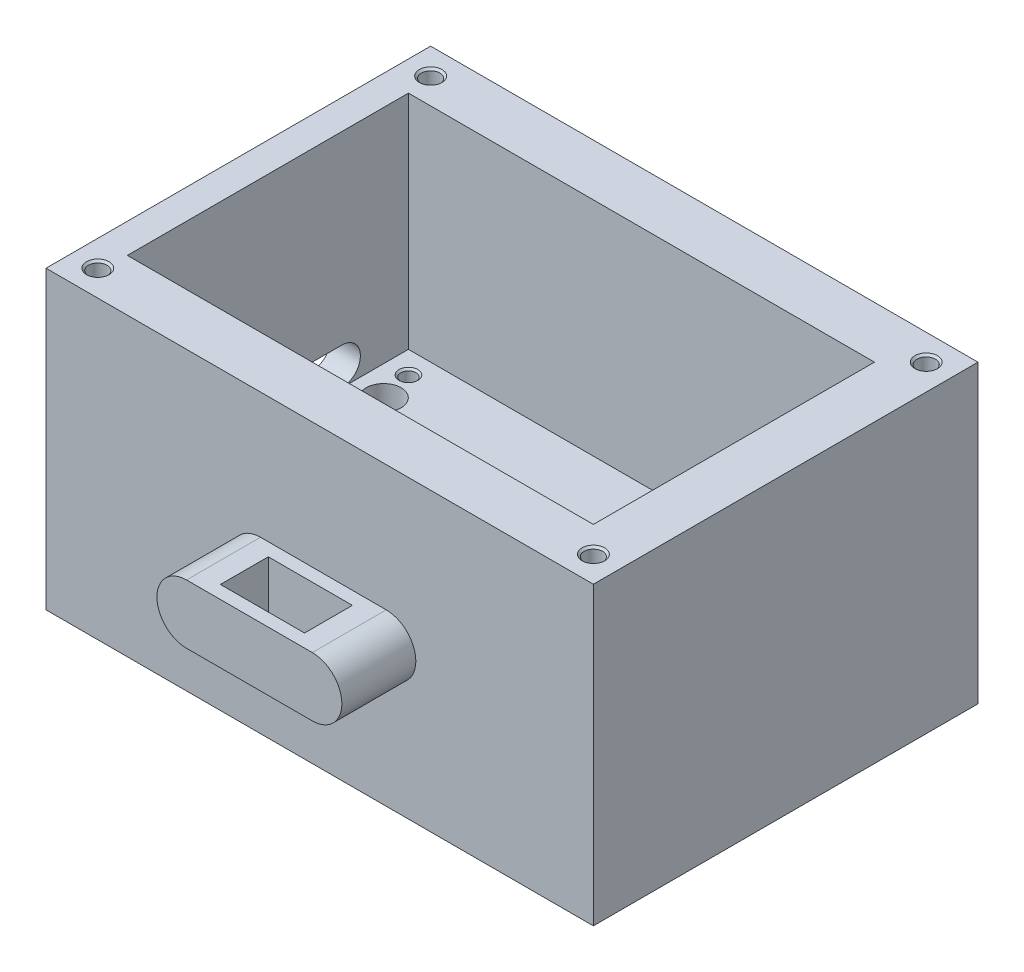
from build123d import *

# Parameters (mm, degrees)
SKETCH1_W                     = 74
SKETCH1_H                     = 52
BOSS_EXTRUDE2_DEPTH           = 40
SHELL3_T                      = -7
SHELL3_THICKNESS_2_FACE_W     = 38
SHELL3_THICKNESS_2_FACE_H     = 60
SHELL3_THICKNESS_2_DEPTH      = 3
SHELL3_THICKNESS_3_FACE_W     = 38
SHELL3_THICKNESS_3_FACE_H     = 30
SHELL3_THICKNESS_3_DEPTH      = 3
M3_TAPPED_HOLE1_D             = 2.5
M3_TAPPED_HOLE1_DEPTH         = 4
M3_TAPPED_HOLE1_CSINK_D       = 3.05
M3_TAPPED_HOLE1_CSINK_ANGLE   = 90
M3_TAPPED_HOLE1_TIP           = 0.751075774
M2_5_TAPPED_HOLE1_D           = 2.05
M2_5_TAPPED_HOLE1_DEPTH       = 4.5
M2_5_TAPPED_HOLE1_CSINK_D     = 2.55
M2_5_TAPPED_HOLE1_CSINK_ANGLE = 90
M2_5_TAPPED_HOLE1_TIP         = 0.615882135
CUT_EXTRUDE2_DEPTH            = 40
SKETCH24_R                    = 2.358495283
CUT_EXTRUDE3_DEPTH            = 40
CUT_EXTRUDE4_DEPTH            = 1
BOSS_EXTRUDE4_DEPTH           = 10
BOSS_EXTRUDE5_START           = 10
BOSS_EXTRUDE5_DEPTH           = 10
SKETCH50_W                    = 11.37301756
SKETCH50_H                    = 6.472311436
CUT_EXTRUDE6_DEPTH            = 10


with BuildPart() as part:
    # Sketch1 → Boss-Extrude2 (new body)
    with BuildSketch(Plane(origin=(0, 0, 0), x_dir=(1, 0, 0), z_dir=(0, 1, 0))):
        Rectangle(SKETCH1_W, SKETCH1_H)
    extrude(amount=BOSS_EXTRUDE2_DEPTH)

    # Shell3
    shell3_openings = [part.faces().sort_by_distance(p)[0] for p in [
        (0, 40, 0),
    ]]
    offset(amount=SHELL3_T, openings=shell3_openings, kind=Kind.INTERSECTION)

    # Shell3 thickness 2 face (on inner face of the shell) → Shell3 thickness 2 (add)
    with BuildSketch(Plane(origin=(0, 7, 0), x_dir=(0, 0, -1), z_dir=(0, -1, 0))):
        Rectangle(SHELL3_THICKNESS_2_FACE_W, SHELL3_THICKNESS_2_FACE_H)
    extrude(amount=-SHELL3_THICKNESS_2_DEPTH)

    # Shell3 thickness 3 face (on inner face of the shell) → Shell3 thickness 3 (cut)
    with BuildSketch(Plane(origin=(-30, 25, 0), x_dir=(0, 0, -1), z_dir=(-1, 0, 0))):
        Rectangle(SHELL3_THICKNESS_3_FACE_W, SHELL3_THICKNESS_3_FACE_H)
    extrude(amount=SHELL3_THICKNESS_3_DEPTH, mode=Mode.SUBTRACT)

    # M3 Tapped Hole1
    with Locations(Plane(origin=(0, 40, 0), x_dir=(1, 0, 0), z_dir=(0, 1, 0))):
        with Locations((-33.5, 22.5), (-33.5, -22.5), (33.5, -22.5), (33.5, 22.5)):
            CounterSinkHole(M3_TAPPED_HOLE1_D / 2, M3_TAPPED_HOLE1_CSINK_D / 2, depth=M3_TAPPED_HOLE1_DEPTH, counter_sink_angle=M3_TAPPED_HOLE1_CSINK_ANGLE)
            with Locations((0, 0, -(M3_TAPPED_HOLE1_DEPTH + M3_TAPPED_HOLE1_TIP / 2))):  # 118° drill point
                Cone(0, M3_TAPPED_HOLE1_D / 2, M3_TAPPED_HOLE1_TIP, mode=Mode.SUBTRACT)

    # M2.5 Tapped Hole1
    with Locations(Plane(origin=(0, 10, 0), x_dir=(1, 0, 0), z_dir=(0, 1, 0))):
        with Locations((-30, 16), (-30, -7), (17, -7), (17, 16)):
            CounterSinkHole(M2_5_TAPPED_HOLE1_D / 2, M2_5_TAPPED_HOLE1_CSINK_D / 2, depth=M2_5_TAPPED_HOLE1_DEPTH, counter_sink_angle=M2_5_TAPPED_HOLE1_CSINK_ANGLE)
            with Locations((0, 0, -(M2_5_TAPPED_HOLE1_DEPTH + M2_5_TAPPED_HOLE1_TIP / 2))):  # 118° drill point
                Cone(0, M2_5_TAPPED_HOLE1_D / 2, M2_5_TAPPED_HOLE1_TIP, mode=Mode.SUBTRACT)

    # Sketch15 → Cut-Extrude2 (cut)
    with BuildSketch(Plane(origin=(-33, 0, 0), x_dir=(0, 0, -1), z_dir=(1, 0, 0))):
        with BuildLine():
            Line((-1, 15), (10, 15))
            ThreePointArc((10, 15), (12.5, 12.5), (10, 10))
            Line((10, 10), (-1, 10))
            ThreePointArc((-1, 10), (-3.5, 12.5), (-1, 15))
        make_face()
    extrude(amount=-CUT_EXTRUDE2_DEPTH, mode=Mode.SUBTRACT)

    # Sketch24 → Cut-Extrude3 (cut)
    with BuildSketch(Plane(origin=(0, 10, 0), x_dir=(1, 0, 0), z_dir=(0, 1, 0))):
        with Locations(Location((-29.004473736, 11.654457193, 0), (0, 0, 270))):
            Circle(SKETCH24_R)
        with Locations(Location((-29.004473736, -2.654457193, 0), (0, 0, 90))):
            Circle(SKETCH24_R)
    extrude(amount=-CUT_EXTRUDE3_DEPTH, mode=Mode.SUBTRACT)

    # Sketch28 → Cut-Extrude4 (cut)
    # profile 1 of 6: a face of its own
    with BuildSketch(Plane.XZ):
        with BuildLine():
            Line((-21.066376407, -7.531290331), (-21.066376407, -8.055729433))
            add(Edge.make_bspline(
                [(-21.066376407, -8.055729433), (-21.066493481, -8.094299967), (-21.066719963, -8.168915559), (-21.072749774, -8.27693019), (-21.081048995, -8.377238794), (-21.091717195, -8.470261613), (-21.107284017, -8.555365956), (-21.125347348, -8.63318104), (-21.1466004, -8.703226112), (-21.180423496, -8.785501362), (-21.231981971, -8.878421953), (-21.307299864, -8.979904321), (-21.400187205, -9.067524933), (-21.504485505, -9.144296198), (-21.618724783, -9.20670145), (-21.739755436, -9.250929045), (-21.865092478, -9.278828123), (-21.950347801, -9.282331474), (-21.993259419, -9.284094818)],
                knots=[0, 0, 0, 0, 1.06018614, 2.050954666, 2.972944401, 3.827238501, 4.623718643, 5.349931156, 6.022584593, 6.633456976, 7.792309932, 8.93465979, 10.093370254, 11.288470473, 12.487312474, 13.658161002, 14.821280605, 16, 16, 16, 16], degree=3))
            add(Edge.make_bspline(
                [(-21.993259419, -9.284094818), (-22.029315806, -9.282784604), (-22.100685306, -9.280191185), (-22.20625438, -9.262372968), (-22.308458266, -9.231788267), (-22.406992389, -9.190093008), (-22.499789336, -9.136681652), (-22.585407581, -9.072359067), (-22.663079019, -8.997075716), (-22.707647061, -8.93993448), (-22.730138426, -8.911098023)],
                knots=[0, 0, 0, 0, 1.008802286, 1.996808917, 2.985853824, 3.987935791, 4.984003692, 5.974085787, 6.977617699, 8, 8, 8, 8], degree=3))
            add(Edge.make_bspline(
                [(-22.730138426, -8.911098023), (-22.757582169, -8.948013976), (-22.811179869, -9.020110928), (-22.903915455, -9.114367701), (-23.002713332, -9.194348448), (-23.108014323, -9.260736498), (-23.221075133, -9.311076519), (-23.340350571, -9.347795106), (-23.466410698, -9.370189878), (-23.55269546, -9.372605673), (-23.596724964, -9.373838407)],
                knots=[0, 0, 0, 0, 1.076867414, 2.103124847, 3.088410714, 4.050300241, 5.011160291, 5.979497965, 6.968975523, 8, 8, 8, 8], degree=3))
            add(Edge.make_bspline(
                [(-23.596724964, -9.373838407), (-23.642689963, -9.372216484), (-23.733631908, -9.369007501), (-23.866364959, -9.339444435), (-23.993710285, -9.294014739), (-24.11216762, -9.229073032), (-24.220858532, -9.152541667), (-24.315033419, -9.064640327), (-24.39440334, -8.968749758), (-24.448433343, -8.880897857), (-24.482877049, -8.804361136), (-24.505166919, -8.74099831), (-24.524284088, -8.671678937), (-24.539060254, -8.596124598), (-24.552180152, -8.51482486), (-24.559829291, -8.427430385), (-24.566070642, -8.334164484), (-24.566272342, -8.269817747), (-24.566376407, -8.236618856)],
                knots=[0, 0, 0, 0, 1.303821814, 2.579616968, 3.843651152, 5.132519217, 6.403349193, 7.610310239, 8.779728434, 9.929465596, 10.526588542, 11.160606602, 11.83532446, 12.566903716, 13.346076185, 14.172979721, 15.057371846, 16, 16, 16, 16], degree=3))
            Line((-24.566376407, -8.236618856), (-24.566376407, -7.040505074))
            Line((-24.566376407, -7.040505074), (-21.066376407, -7.531290331))
        make_face()
        with BuildLine():
            Line((-22.457402048, -7.968790331), (-22.457402048, -8.083774305))
            add(Edge.make_bspline(
                [(-22.457402048, -8.083774305), (-22.457310171, -8.104578187), (-22.457134624, -8.144327724), (-22.454662489, -8.201104012), (-22.452492769, -8.252857304), (-22.447151493, -8.299308203), (-22.442087999, -8.340833196), (-22.434699294, -8.376745303), (-22.427647017, -8.40801075), (-22.414402069, -8.442315778), (-22.393192786, -8.480824328), (-22.358512423, -8.52163605), (-22.31632509, -8.559753033), (-22.26583748, -8.592915553), (-22.209669148, -8.620800675), (-22.149315493, -8.64111813), (-22.08583696, -8.653439438), (-22.042626966, -8.655062452), (-22.020603169, -8.655889689)],
                knots=[0, 0, 0, 0, 1.199266251, 2.2914127, 3.276493939, 4.184169076, 4.986412771, 5.686674651, 6.297778951, 6.830813506, 7.80188044, 8.816289487, 9.903938403, 11.069891582, 12.287113832, 13.509990689, 14.730861672, 16, 16, 16, 16], degree=3))
            add(Edge.make_bspline(
                [(-22.020603169, -8.655889689), (-22.000460654, -8.655233615), (-21.961056668, -8.653950164), (-21.904341876, -8.643501645), (-21.851954912, -8.625625951), (-21.804582942, -8.601149865), (-21.762261832, -8.571423136), (-21.727687289, -8.536004149), (-21.70016231, -8.496535774), (-21.683516978, -8.459300799), (-21.673338741, -8.425088648), (-21.66744149, -8.393320944), (-21.661814447, -8.355911062), (-21.656920366, -8.312661533), (-21.653514229, -8.263539923), (-21.651655834, -8.208585036), (-21.650210513, -8.147817206), (-21.649881474, -8.105276356), (-21.64970974, -8.083073183)],
                knots=[0, 0, 0, 0, 1.218011353, 2.382746143, 3.473745603, 4.555082274, 5.598789101, 6.588623339, 7.533826788, 8.495697709, 9.041472227, 9.69032969, 10.448187854, 11.330378243, 12.32263311, 13.426294144, 14.656716176, 16, 16, 16, 16], degree=3))
            Line((-21.64970974, -8.083073183), (-22.457402048, -7.968790331))
        make_face(mode=Mode.SUBTRACT)
        with BuildLine():
            Line((-23.983043073, -7.756350427), (-23.997065509, -8.161598824))
            add(Edge.make_bspline(
                [(-23.997065509, -8.161598824), (-23.996641291, -8.186149952), (-23.99581998, -8.233682309), (-23.990106233, -8.302505842), (-23.981367683, -8.366305178), (-23.968334625, -8.424854199), (-23.950174509, -8.477742066), (-23.93057028, -8.526425285), (-23.905869187, -8.569616256), (-23.87688385, -8.607214856), (-23.844021719, -8.639199204), (-23.809893626, -8.668745522), (-23.771849867, -8.692325501), (-23.731039327, -8.711516139), (-23.68782649, -8.72677893), (-23.641647414, -8.738342169), (-23.592682526, -8.744402481), (-23.559112775, -8.745218308), (-23.542037464, -8.745633279)],
                knots=[0, 0, 0, 0, 1.396066714, 2.702863338, 3.924573081, 5.056214113, 6.106916433, 7.10166022, 8.036348374, 8.926907695, 9.791502282, 10.640636188, 11.488729362, 12.326976486, 13.201322448, 14.090988778, 15.028978228, 16, 16, 16, 16], degree=3))
            add(Edge.make_bspline(
                [(-23.542037464, -8.745633279), (-23.516701752, -8.744574141), (-23.467132268, -8.74250193), (-23.395036356, -8.725576567), (-23.327085828, -8.69889822), (-23.264095559, -8.661528655), (-23.207383741, -8.615852819), (-23.159803334, -8.561447237), (-23.120765214, -8.500603102), (-23.095798792, -8.443281247), (-23.080072453, -8.39089617), (-23.071025345, -8.342861682), (-23.061289369, -8.287123898), (-23.055231724, -8.222867608), (-23.048348161, -8.150723919), (-23.044648393, -8.070479705), (-23.041729912, -7.982132302), (-23.041076744, -7.920415987), (-23.040735381, -7.888161324)],
                knots=[0, 0, 0, 0, 1.072645095, 2.098636998, 3.121276761, 4.155791168, 5.190684831, 6.194199094, 7.205309944, 8.243185402, 8.832331474, 9.519981703, 10.31298152, 11.2295869, 12.253664638, 13.384370407, 14.632999216, 16, 16, 16, 16], degree=3))
            Line((-23.040735381, -7.888161324), (-23.983043073, -7.756350427))
        make_face(mode=Mode.SUBTRACT)
    # profile 2 of 6: a face of its own
    with BuildSketch(Plane.XZ):
        with BuildLine():
            add(Edge.make_bspline(
                [(-21.963812304, -11.297716613), (-21.964071323, -11.32601783), (-21.964583955, -11.382029728), (-21.973085168, -11.465058538), (-21.984445156, -11.546164685), (-22.001588258, -11.625275701), (-22.023164205, -11.702383431), (-22.050079806, -11.77771802), (-22.081319282, -11.851199178), (-22.118011107, -11.921980931), (-22.158552322, -11.990012085), (-22.203266686, -12.054666239), (-22.252796154, -12.114867426), (-22.305209547, -12.172303544), (-22.362883564, -12.224554999), (-22.424176414, -12.273042191), (-22.489053427, -12.318351228), (-22.557914297, -12.359414813), (-22.630337386, -12.395576586), (-22.704464204, -12.428232667), (-22.781437115, -12.454915125), (-22.860521725, -12.476164592), (-22.941538799, -12.494470213), (-23.024855905, -12.505523666), (-23.110201586, -12.51413082), (-23.167848537, -12.514617313), (-23.197085541, -12.514864048)],
                knots=[0, 0, 0, 0, 1.048386327, 2.074896855, 3.090385118, 4.082517109, 5.072415802, 6.055927494, 7.045409252, 8.029378534, 9.00830257, 9.979030121, 10.939501578, 11.895667195, 12.858206409, 13.820004862, 14.790732413, 15.788970817, 16.788373479, 17.78923893, 18.789091909, 19.804025916, 20.823385529, 21.864591044, 22.916977224, 24, 24, 24, 24], degree=3))
            add(Edge.make_bspline(
                [(-23.197085541, -12.514864048), (-23.245291767, -12.513431398), (-23.340238093, -12.510609669), (-23.479910674, -12.490823337), (-23.613810475, -12.457012039), (-23.742309564, -12.409660517), (-23.865498587, -12.349153494), (-23.983149544, -12.275031015), (-24.095008815, -12.187480316), (-24.200289717, -12.08779976), (-24.295928121, -11.977904364), (-24.381214384, -11.861165345), (-24.451771511, -11.737103133), (-24.510860689, -11.607355617), (-24.555506622, -11.47060455), (-24.587537122, -11.327878884), (-24.608018449, -11.178884395), (-24.610157924, -11.077398548), (-24.611248202, -11.025681356)],
                knots=[0, 0, 0, 0, 1.011045048, 1.991340582, 2.952024262, 3.902762956, 4.858644223, 5.82568574, 6.814147443, 7.833642768, 8.862033131, 9.866161463, 10.860924258, 11.85045512, 12.85189938, 13.872278278, 14.915712917, 16, 16, 16, 16], degree=3))
            add(Edge.make_bspline(
                [(-24.611248202, -11.025681356), (-24.610422814, -10.980993326), (-24.608810024, -10.893673902), (-24.592814058, -10.766335957), (-24.567947609, -10.645582502), (-24.532207479, -10.53189733), (-24.486430645, -10.425215958), (-24.430601399, -10.325519237), (-24.364738295, -10.232506784), (-24.287984288, -10.148161236), (-24.204018253, -10.071416656), (-24.112715688, -10.004778704), (-24.014961248, -9.948165691), (-23.911229935, -9.901634218), (-23.800658146, -9.866976675), (-23.684677745, -9.840742838), (-23.562096836, -9.825090456), (-23.478280742, -9.82341314), (-23.435466952, -9.822556356)],
                knots=[0, 0, 0, 0, 1.130479594, 2.208932189, 3.242528798, 4.24708251, 5.219446299, 6.175409344, 7.133894192, 8.097148648, 9.056016668, 10.008368175, 10.951843583, 11.910328432, 12.879268204, 13.879441713, 14.916805437, 16, 16, 16, 16], degree=3))
            add(Edge.make_bspline(
                [(-23.435466952, -9.822556356), (-23.383756982, -9.823942902), (-23.282032104, -9.826670543), (-23.132707369, -9.847014665), (-22.990483056, -9.882395552), (-22.854723047, -9.930837424), (-22.726059814, -9.993646898), (-22.603572287, -10.069860199), (-22.488587188, -10.16084656), (-22.381507552, -10.264108762), (-22.284190555, -10.376223895), (-22.197995353, -10.493777249), (-22.126574424, -10.616934393), (-22.065683282, -10.743423319), (-22.020671406, -10.875946629), (-21.987434701, -11.012433403), (-21.967173913, -11.153612011), (-21.964942376, -11.249272968), (-21.963812304, -11.297716613)],
                knots=[0, 0, 0, 0, 1.070531339, 2.105970474, 3.112964683, 4.100244114, 5.084970514, 6.071870378, 7.081570052, 8.115141744, 9.147591351, 10.152304076, 11.128312213, 12.091581256, 13.054169389, 14.02010879, 14.997363732, 16, 16, 16, 16], degree=3))
        make_face()
        with BuildLine():
            add(Edge.make_bspline(
                [(-22.547145637, -11.251442574), (-22.547908418, -11.220081751), (-22.549394997, -11.158962825), (-22.562254011, -11.070113336), (-22.583207164, -10.986861605), (-22.612524034, -10.908876392), (-22.6516997, -10.837263227), (-22.697833368, -10.770341036), (-22.754279144, -10.710794596), (-22.816909708, -10.656509872), (-22.884755563, -10.608638093), (-22.954765871, -10.5668093), (-23.025841141, -10.530205756), (-23.099022945, -10.502133489), (-23.172963659, -10.478157138), (-23.248640258, -10.462287833), (-23.325863237, -10.453071702), (-23.377716517, -10.45153695), (-23.403916471, -10.450761484)],
                knots=[0, 0, 0, 0, 1.147823303, 2.236986163, 3.278866926, 4.286447048, 5.278094165, 6.260951849, 7.253964134, 8.273106082, 9.291744946, 10.289685726, 11.257906124, 12.214523359, 13.156367631, 14.101277975, 15.040631004, 16, 16, 16, 16], degree=3))
            add(Edge.make_bspline(
                [(-23.403916471, -10.450761484), (-23.426838522, -10.451344365), (-23.47164654, -10.45248378), (-23.537178707, -10.46008734), (-23.599050878, -10.473588385), (-23.657713573, -10.491579537), (-23.712850526, -10.51578007), (-23.764679947, -10.544977699), (-23.812668956, -10.580035133), (-23.857778703, -10.61875424), (-23.897173961, -10.663193391), (-23.933018386, -10.710269278), (-23.962387293, -10.761764805), (-23.986192618, -10.816897877), (-24.005201102, -10.875062926), (-24.018609618, -10.936825639), (-24.026194126, -11.002119655), (-24.027332513, -11.046929198), (-24.027914868, -11.069852029)],
                knots=[0, 0, 0, 0, 1.110072676, 2.169969703, 3.188890406, 4.173283012, 5.136298252, 6.099313492, 7.047922057, 8.010405097, 8.971956079, 9.918130923, 10.871319561, 11.834334801, 12.822169691, 13.830030297, 14.889927324, 16, 16, 16, 16], degree=3))
            add(Edge.make_bspline(
                [(-24.027914868, -11.069852029), (-24.027083372, -11.102139252), (-24.025462658, -11.165071982), (-24.013581477, -11.256495164), (-23.993405887, -11.341900569), (-23.964520504, -11.421263253), (-23.926997267, -11.494500215), (-23.882163052, -11.562511181), (-23.828148792, -11.62375824), (-23.767204356, -11.678898876), (-23.701031157, -11.727384063), (-23.631613206, -11.769586311), (-23.560578331, -11.806589697), (-23.486148861, -11.834816532), (-23.410481789, -11.858587739), (-23.331986267, -11.87440774), (-23.251338062, -11.884551176), (-23.196648986, -11.885951835), (-23.169040669, -11.88665892)],
                knots=[0, 0, 0, 0, 1.164159755, 2.269125213, 3.317790587, 4.322983768, 5.306749412, 6.279149638, 7.252754391, 8.243176293, 9.237713415, 10.206161075, 11.171081751, 12.121090975, 13.072855638, 14.02823303, 15.004606195, 16, 16, 16, 16], degree=3))
            add(Edge.make_bspline(
                [(-23.169040669, -11.88665892), (-23.146571924, -11.886162759), (-23.102407058, -11.885187496), (-23.0379783, -11.876270421), (-22.976394128, -11.863630613), (-22.918732447, -11.843244271), (-22.863464789, -11.819226848), (-22.812393521, -11.787873708), (-22.764172286, -11.751837125), (-22.719411761, -11.71059691), (-22.679114042, -11.664674304), (-22.643762297, -11.615054966), (-22.613368049, -11.562698642), (-22.589558086, -11.506474053), (-22.570650952, -11.447324035), (-22.556369202, -11.385004941), (-22.548903794, -11.319166522), (-22.547740655, -11.274362554), (-22.547145637, -11.251442574)],
                knots=[0, 0, 0, 0, 1.078934166, 2.120767328, 3.120729662, 4.093721461, 5.053732062, 6.010848681, 6.965326793, 7.94277936, 8.929412498, 9.895380872, 10.866167073, 11.831939623, 12.822717627, 13.847035637, 14.898626599, 16, 16, 16, 16], degree=3))
        make_face(mode=Mode.SUBTRACT)
    # profile 3 of 6: a face of its own
    with BuildSketch(Plane.XZ):
        with BuildLine():
            add(Edge.make_bspline(
                [(-21.963812304, -14.393870459), (-21.964071323, -14.422171676), (-21.964583955, -14.478183574), (-21.973085168, -14.561212384), (-21.984445156, -14.642318531), (-22.001588258, -14.721429547), (-22.023164205, -14.798537277), (-22.050079806, -14.873871866), (-22.081319282, -14.947353025), (-22.118011107, -15.018134777), (-22.158552322, -15.086165931), (-22.203266686, -15.150820085), (-22.252796154, -15.211021272), (-22.305209547, -15.26845739), (-22.362883564, -15.320708845), (-22.424176414, -15.369196037), (-22.489053427, -15.414505074), (-22.557914297, -15.455568659), (-22.630337386, -15.491730432), (-22.704464204, -15.524386513), (-22.781437115, -15.551068971), (-22.860521725, -15.572318439), (-22.941538799, -15.590624059), (-23.024855905, -15.601677512), (-23.110201586, -15.610284667), (-23.167848537, -15.610771159), (-23.197085541, -15.611017895)],
                knots=[0, 0, 0, 0, 1.048386327, 2.074896855, 3.090385118, 4.082517109, 5.072415802, 6.055927494, 7.045409252, 8.029378534, 9.00830257, 9.979030121, 10.939501578, 11.895667195, 12.858206409, 13.820004862, 14.790732413, 15.788970817, 16.788373479, 17.78923893, 18.789091909, 19.804025916, 20.823385529, 21.864591044, 22.916977224, 24, 24, 24, 24], degree=3))
            add(Edge.make_bspline(
                [(-23.197085541, -15.611017895), (-23.245291767, -15.609585244), (-23.340238093, -15.606763515), (-23.479910674, -15.586977183), (-23.613810475, -15.553165885), (-23.742309564, -15.505814363), (-23.865498587, -15.445307341), (-23.983149544, -15.371184861), (-24.095008815, -15.283634162), (-24.200289717, -15.183953606), (-24.295928121, -15.074058211), (-24.381214384, -14.957319191), (-24.451771511, -14.833256979), (-24.510860689, -14.703509464), (-24.555506622, -14.566758396), (-24.587537122, -14.42403273), (-24.608018449, -14.275038241), (-24.610157924, -14.173552394), (-24.611248202, -14.121835202)],
                knots=[0, 0, 0, 0, 1.011045048, 1.991340582, 2.952024262, 3.902762956, 4.858644223, 5.82568574, 6.814147443, 7.833642768, 8.862033131, 9.866161463, 10.860924258, 11.85045512, 12.85189938, 13.872278278, 14.915712917, 16, 16, 16, 16], degree=3))
            add(Edge.make_bspline(
                [(-24.611248202, -14.121835202), (-24.610422814, -14.077147173), (-24.608810024, -13.989827748), (-24.592814058, -13.862489804), (-24.567947609, -13.741736348), (-24.532207479, -13.628051176), (-24.486430645, -13.521369804), (-24.430601399, -13.421673083), (-24.364738295, -13.32866063), (-24.287984288, -13.244315082), (-24.204018253, -13.167570502), (-24.112715688, -13.10093255), (-24.014961248, -13.044319537), (-23.911229935, -12.997788064), (-23.800658146, -12.963130522), (-23.684677745, -12.936896685), (-23.562096836, -12.921244303), (-23.478280742, -12.919566986), (-23.435466952, -12.918710202)],
                knots=[0, 0, 0, 0, 1.130479594, 2.208932189, 3.242528798, 4.24708251, 5.219446299, 6.175409344, 7.133894192, 8.097148648, 9.056016668, 10.008368175, 10.951843583, 11.910328432, 12.879268204, 13.879441713, 14.916805437, 16, 16, 16, 16], degree=3))
            add(Edge.make_bspline(
                [(-23.435466952, -12.918710202), (-23.383756982, -12.920096748), (-23.282032104, -12.922824389), (-23.132707369, -12.943168511), (-22.990483056, -12.978549398), (-22.854723047, -13.02699127), (-22.726059814, -13.089800744), (-22.603572287, -13.166014045), (-22.488587188, -13.257000406), (-22.381507552, -13.360262609), (-22.284190555, -13.472377741), (-22.197995353, -13.589931095), (-22.126574424, -13.71308824), (-22.065683282, -13.839577166), (-22.020671406, -13.972100475), (-21.987434701, -14.108587249), (-21.967173913, -14.249765857), (-21.964942376, -14.345426815), (-21.963812304, -14.393870459)],
                knots=[0, 0, 0, 0, 1.070531339, 2.105970474, 3.112964683, 4.100244114, 5.084970514, 6.071870378, 7.081570052, 8.115141744, 9.147591351, 10.152304076, 11.128312213, 12.091581256, 13.054169389, 14.02010879, 14.997363732, 16, 16, 16, 16], degree=3))
        make_face()
        with BuildLine():
            add(Edge.make_bspline(
                [(-22.547145637, -14.34759642), (-22.547908418, -14.316235597), (-22.549394997, -14.255116672), (-22.562254011, -14.166267182), (-22.583207164, -14.083015451), (-22.612524034, -14.005030238), (-22.6516997, -13.933417073), (-22.697833368, -13.866494882), (-22.754279144, -13.806948442), (-22.816909708, -13.752663718), (-22.884755563, -13.704791939), (-22.954765871, -13.662963146), (-23.025841141, -13.626359602), (-23.099022945, -13.598287335), (-23.172963659, -13.574310984), (-23.248640258, -13.558441679), (-23.325863237, -13.549225548), (-23.377716517, -13.547690796), (-23.403916471, -13.546915331)],
                knots=[0, 0, 0, 0, 1.147823303, 2.236986163, 3.278866926, 4.286447048, 5.278094165, 6.260951849, 7.253964134, 8.273106082, 9.291744946, 10.289685726, 11.257906124, 12.214523359, 13.156367631, 14.101277975, 15.040631004, 16, 16, 16, 16], degree=3))
            add(Edge.make_bspline(
                [(-23.403916471, -13.546915331), (-23.426838522, -13.547498211), (-23.47164654, -13.548637626), (-23.537178707, -13.556241186), (-23.599050878, -13.569742231), (-23.657713573, -13.587733383), (-23.712850526, -13.611933916), (-23.764679947, -13.641131545), (-23.812668956, -13.676188979), (-23.857778703, -13.714908086), (-23.897173961, -13.759347237), (-23.933018386, -13.806423124), (-23.962387293, -13.857918651), (-23.986192618, -13.913051723), (-24.005201102, -13.971216772), (-24.018609618, -14.032979485), (-24.026194126, -14.098273501), (-24.027332513, -14.143083044), (-24.027914868, -14.166005875)],
                knots=[0, 0, 0, 0, 1.110072676, 2.169969703, 3.188890406, 4.173283012, 5.136298252, 6.099313492, 7.047922057, 8.010405097, 8.971956079, 9.918130923, 10.871319561, 11.834334801, 12.822169691, 13.830030297, 14.889927324, 16, 16, 16, 16], degree=3))
            add(Edge.make_bspline(
                [(-24.027914868, -14.166005875), (-24.027083372, -14.198293098), (-24.025462658, -14.261225828), (-24.013581477, -14.35264901), (-23.993405887, -14.438054415), (-23.964520504, -14.517417099), (-23.926997267, -14.590654061), (-23.882163052, -14.658665027), (-23.828148792, -14.719912087), (-23.767204356, -14.775052722), (-23.701031157, -14.823537909), (-23.631613206, -14.865740157), (-23.560578331, -14.902743544), (-23.486148861, -14.930970378), (-23.410481789, -14.954741585), (-23.331986267, -14.970561586), (-23.251338062, -14.980705022), (-23.196648986, -14.982105681), (-23.169040669, -14.982812766)],
                knots=[0, 0, 0, 0, 1.164159755, 2.269125213, 3.317790587, 4.322983768, 5.306749412, 6.279149638, 7.252754391, 8.243176293, 9.237713415, 10.206161075, 11.171081751, 12.121090975, 13.072855638, 14.02823303, 15.004606195, 16, 16, 16, 16], degree=3))
            add(Edge.make_bspline(
                [(-23.169040669, -14.982812766), (-23.146571924, -14.982316605), (-23.102407058, -14.981341343), (-23.0379783, -14.972424268), (-22.976394128, -14.95978446), (-22.918732447, -14.939398117), (-22.863464789, -14.915380695), (-22.812393521, -14.884027554), (-22.764172286, -14.847990972), (-22.719411761, -14.806750756), (-22.679114042, -14.76082815), (-22.643762297, -14.711208812), (-22.613368049, -14.658852488), (-22.589558086, -14.602627899), (-22.570650952, -14.543477882), (-22.556369202, -14.481158787), (-22.548903794, -14.415320368), (-22.547740655, -14.3705164), (-22.547145637, -14.34759642)],
                knots=[0, 0, 0, 0, 1.078934166, 2.120767328, 3.120729662, 4.093721461, 5.053732062, 6.010848681, 6.965326793, 7.94277936, 8.929412498, 9.895380872, 10.866167073, 11.831939623, 12.822717627, 13.847035637, 14.898626599, 16, 16, 16, 16], degree=3))
        make_face(mode=Mode.SUBTRACT)
    # profile 4 of 6: a face of its own
    with BuildSketch(Plane.XZ):
        Polygon((-20.976632817, -16.467788728), (-20.976632817, -17.100901709), (-22.008684099, -16.957872863), (-22.008684099, -17.358213407), (-22.547145637, -17.282492254), (-22.547145637, -16.882852831), (-24.566376407, -16.603105234), (-24.566376407, -15.969992254), (-22.547145637, -16.24973985), (-22.547145637, -15.939844016), (-22.008684099, -16.012760683), (-22.008684099, -16.324759882), align=None)
    # profile 5 of 6: a face of its own
    with BuildSketch(Plane.XZ):
        with BuildLine():
            Line((-22.008684099, 2.381019693), (-22.008684099, 1.747205591))
            Line((-22.008684099, 1.747205591), (-22.291236182, 1.787169533))
            add(Edge.make_bspline(
                [(-22.291236182, 1.787169533), (-22.265291446, 1.756692132), (-22.214575462, 1.697115832), (-22.148048357, 1.60340385), (-22.090541591, 1.509702458), (-22.044766259, 1.414152843), (-22.008667572, 1.31774243), (-21.98273504, 1.220335761), (-21.96645586, 1.121886127), (-21.964694413, 1.055961125), (-21.963812304, 1.022946777)],
                knots=[0, 0, 0, 0, 1.129041565, 2.207016167, 3.23971273, 4.22791817, 5.192060896, 6.140739953, 7.068907738, 8, 8, 8, 8], degree=3))
            add(Edge.make_bspline(
                [(-21.963812304, 1.022946777), (-21.964596211, 0.995349717), (-21.966135082, 0.941174502), (-21.974946133, 0.861759782), (-21.991252165, 0.786472586), (-22.013701344, 0.714726686), (-22.043346482, 0.647105114), (-22.078217182, 0.58248745), (-22.120963002, 0.522792247), (-22.168820542, 0.466896302), (-22.222083196, 0.416876578), (-22.278201884, 0.37212345), (-22.338187401, 0.334707501), (-22.401827546, 0.304554458), (-22.46866739, 0.28043071), (-22.538995886, 0.263777656), (-22.612530447, 0.253799051), (-22.662565471, 0.252417206), (-22.688071118, 0.251712802)],
                knots=[0, 0, 0, 0, 1.117704281, 2.194142108, 3.229874435, 4.232522575, 5.232845626, 6.215464044, 7.200085579, 8.199871303, 9.190613486, 10.154273447, 11.102238714, 12.046180242, 13.001064197, 13.974295566, 14.967385269, 16, 16, 16, 16], degree=3))
            add(Edge.make_bspline(
                [(-22.688071118, 0.251712802), (-22.715661125, 0.252400031), (-22.776766004, 0.253922068), (-22.87751304, 0.262464629), (-22.996274802, 0.274969881), (-23.081426669, 0.286311418), (-23.126973362, 0.292377867)],
                knots=[0, 0, 0, 0, 0.750784848, 1.662798329, 2.749859395, 4, 4, 4, 4], degree=3))
            Line((-23.126973362, 0.292377867), (-24.566376407, 0.495002065))
            Line((-24.566376407, 0.495002065), (-24.566376407, 1.128816168))
            Line((-24.566376407, 1.128816168), (-23.158523843, 0.9303987))
            add(Edge.make_bspline(
                [(-23.158523843, 0.9303987), (-23.126522089, 0.926070723), (-23.066796087, 0.917993267), (-22.98361927, 0.908535431), (-22.913188755, 0.90353806), (-22.870601463, 0.902237915), (-22.851432496, 0.901652706)],
                knots=[0, 0, 0, 0, 1.255630561, 2.343427635, 3.254360171, 4, 4, 4, 4], degree=3))
            add(Edge.make_bspline(
                [(-22.851432496, 0.901652706), (-22.828432421, 0.902654179), (-22.784321458, 0.904574865), (-22.721968136, 0.921235094), (-22.668793792, 0.950910706), (-22.623853555, 0.991035352), (-22.589734521, 1.04278218), (-22.563982803, 1.10346424), (-22.549612389, 1.174202237), (-22.547998039, 1.224338612), (-22.547145637, 1.25081136)],
                knots=[0, 0, 0, 0, 1.048053663, 2.010021926, 2.911760624, 3.802279052, 4.730588973, 5.714510545, 6.793227699, 8, 8, 8, 8], degree=3))
            add(Edge.make_bspline(
                [(-22.547145637, 1.25081136), (-22.548659299, 1.27802026), (-22.551724341, 1.333116058), (-22.571965063, 1.415773975), (-22.607504284, 1.497241544), (-22.653824496, 1.577986436), (-22.712298754, 1.654404245), (-22.78298689, 1.721926256), (-22.864069278, 1.779911839), (-22.940280626, 1.820760855), (-23.010343657, 1.84917482), (-23.074166853, 1.870004245), (-23.148280294, 1.890941656), (-23.233009693, 1.910998487), (-23.328230258, 1.93051429), (-23.433625826, 1.950066506), (-23.549791986, 1.969089842), (-23.630820264, 1.980386865), (-23.67314724, 1.986288123)],
                knots=[0, 0, 0, 0, 0.88219834, 1.786379494, 2.740517003, 3.755531365, 4.798223375, 5.848568323, 6.912598417, 8.021077841, 8.642996705, 9.361819284, 10.196534327, 11.1393222, 12.183994529, 13.347633871, 14.614475823, 16, 16, 16, 16], degree=3))
            Line((-23.67314724, 1.986288123), (-24.566376407, 2.110386681))
            Line((-24.566376407, 2.110386681), (-24.566376407, 2.744200783))
            Line((-24.566376407, 2.744200783), (-22.008684099, 2.381019693))
        make_face()
    # profile 6 of 6: a face of its own
    with BuildSketch(Plane.XZ):
        Polygon((-21.066376407, 4.76623604), (-21.066376407, 2.878816168), (-21.64970974, 2.952433956), (-21.64970974, 4.213752065), (-22.457402048, 4.327333796), (-22.457402048, 3.054096617), (-23.040735381, 3.128415527), (-23.040735381, 4.409365046), (-23.983043073, 4.541175943), (-23.983043073, 3.24690511), (-24.566376407, 3.320522899), (-24.566376407, 5.257021296), align=None)
    extrude(amount=-CUT_EXTRUDE4_DEPTH, mode=Mode.SUBTRACT)

    # Sketch48 → Boss-Extrude4 (add)
    with BuildSketch(Plane(origin=(0, 0, -26), x_dir=(-1, 0, 0), z_dir=(0, 0, -1))):
        with BuildLine():
            Line((-9, 23), (8, 23))
            ThreePointArc((8, 23), (12, 19), (8, 15))
            Line((8, 15), (-9, 15))
            ThreePointArc((-9, 15), (-13, 19), (-9, 23))
        make_face()
    extrude(amount=BOSS_EXTRUDE4_DEPTH)

    # Sketch45 → Boss-Extrude5 (add)
    with BuildSketch(Plane.XY.offset(26).offset(BOSS_EXTRUDE5_START)):
        with BuildLine():
            Line((-8, 23), (9, 23))
            ThreePointArc((9, 23), (13, 19), (9, 15))
            Line((9, 15), (-8, 15))
            ThreePointArc((-8, 15), (-12, 19), (-8, 23))
        make_face()
    extrude(amount=-BOSS_EXTRUDE5_DEPTH)

    # Sketch50 → Cut-Extrude6 (cut)
    with BuildSketch(Plane(origin=(0, 23, 0), x_dir=(1, 0, 0), z_dir=(0, 1, 0))):
        with Locations((0.5, 31)):
            Rectangle(SKETCH50_W, SKETCH50_H)
        with Locations((0.5, -31)):
            Rectangle(SKETCH50_W, SKETCH50_H)
    extrude(amount=-CUT_EXTRUDE6_DEPTH, mode=Mode.SUBTRACT)


solid = part.part
